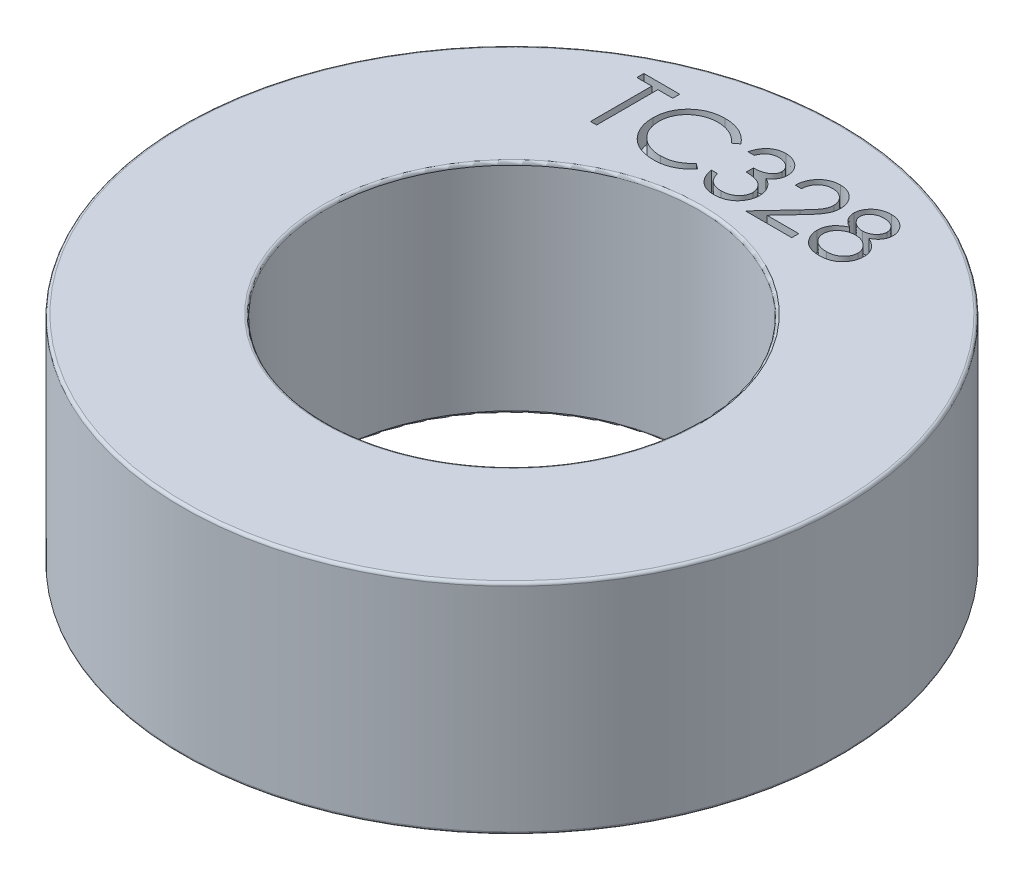
from build123d import *

# Parameters (mm, degrees)
CUT_EXTRUDE1_DEPTH = 1


with BuildPart() as part:
    # Toroidal Core TC328 → Revolve2 (revolve)
    with BuildSketch(Plane.XY, mode=Mode.PRIVATE) as revolve2_sk:
        with BuildLine():
            Line((9.696058459, 0), (16.753941541, 0))
            ThreePointArc((16.753941541, 0), (16.857220468, 0.042779532), (16.9, 0.146058459))
            Line((16.9, 0.146058459), (16.9, 11.053941541))
            ThreePointArc((16.9, 11.053941541), (16.857220468, 11.157220468), (16.753941541, 11.2))
            Line((16.753941541, 11.2), (9.696058459, 11.2))
            ThreePointArc((9.696058459, 11.2), (9.592779532, 11.157220468), (9.55, 11.053941541))
            Line((9.55, 11.053941541), (9.55, 0.146058459))
            ThreePointArc((9.55, 0.146058459), (9.592779532, 0.042779532), (9.696058459, 0))
        make_face()
    revolve(revolve2_sk.sketch.rotate(Axis((0, -8.107972275, 0), (0, 1, 0)), 90), axis=Axis((0, -8.107972275, 0), (0, 1, 0)))

    # Sketch1 → Cut-Extrude1 (cut)
    # profile 1 of 5: a face of its own
    with BuildSketch(Plane(origin=(0, 11.2, 0), x_dir=(1, 0, 0), z_dir=(0, 1, 0))):
        Polygon((-7.295148768, 13.702178807), (-7.295148768, 14.061153166), (-5.455405178, 14.061153166), (-5.455405178, 13.702178807), (-6.218225691, 13.702178807), (-6.218225691, 10.561153166), (-6.532328255, 10.561153166), (-6.532328255, 13.702178807), align=None)
    # profile 2 of 5: a face of its own
    with BuildSketch(Plane(origin=(0, 11.2, 0), x_dir=(1, 0, 0), z_dir=(0, 1, 0))):
        with BuildLine():
            Line((-1.686174409, 13.418925602), (-1.961014153, 13.208589063))
            add(Edge.make_bspline(
                [(-1.961014153, 13.208589063), (-1.980620041, 13.231955033), (-2.019567488, 13.278371949), (-2.08222669, 13.343551494), (-2.147528333, 13.404616755), (-2.215447454, 13.461858635), (-2.287206574, 13.5132754), (-2.361067373, 13.561546503), (-2.438265418, 13.604814241), (-2.545017152, 13.657277227), (-2.684665001, 13.712023382), (-2.86045984, 13.757926614), (-3.043970938, 13.787147789), (-3.169168538, 13.790312631), (-3.232849089, 13.791922397)],
                knots=[0, 0, 0, 0, 0.757959112, 1.505699292, 2.245454638, 2.979532153, 3.711538275, 4.438200793, 5.171680507, 5.909471876, 7.393775596, 8.890124382, 10.418191784, 12, 12, 12, 12], degree=3))
            add(Edge.make_bspline(
                [(-3.232849089, 13.791922397), (-3.267932388, 13.791518434), (-3.33777338, 13.790714258), (-3.441421854, 13.780105133), (-3.543134905, 13.765193923), (-3.642846371, 13.7430686), (-3.74042933, 13.715095981), (-3.836521732, 13.681670567), (-3.929732332, 13.640315727), (-4.02135057, 13.594607467), (-4.109129781, 13.542980022), (-4.192184829, 13.486666671), (-4.270212797, 13.426297574), (-4.343275409, 13.361646468), (-4.411447357, 13.293004507), (-4.474234668, 13.219640166), (-4.531420078, 13.141787992), (-4.584137103, 13.060474585), (-4.631349837, 12.975936793), (-4.670879716, 12.887861722), (-4.705884838, 12.797757619), (-4.733584081, 12.704606459), (-4.755508598, 12.609063693), (-4.770636261, 12.510872905), (-4.781124732, 12.410239225), (-4.781924909, 12.342029913), (-4.782328255, 12.307647557)],
                knots=[0, 0, 0, 0, 1.054917814, 2.100044995, 3.131103042, 4.146048494, 5.169673617, 6.183595914, 7.203665975, 8.234915748, 9.262203917, 10.264457458, 11.251630812, 12.227803204, 13.197192746, 14.159520551, 15.12972552, 16.100847026, 17.073214652, 18.039054194, 19.002613845, 19.979014051, 20.95965708, 21.949030935, 22.966165397, 24, 24, 24, 24], degree=3))
            add(Edge.make_bspline(
                [(-4.782328255, 12.307647557), (-4.781066436, 12.255916237), (-4.778589022, 12.154348652), (-4.756540688, 12.005578042), (-4.723035597, 11.863057368), (-4.67282002, 11.727677526), (-4.610900969, 11.597769168), (-4.532660358, 11.475530314), (-4.44204382, 11.35911375), (-4.337769401, 11.251270802), (-4.223363585, 11.152757077), (-4.100615673, 11.066006495), (-3.969831385, 10.993691613), (-3.832454755, 10.933515666), (-3.687428641, 10.887258938), (-3.535013839, 10.854694815), (-3.375541844, 10.833452634), (-3.266572444, 10.831418946), (-3.211114313, 10.830383935)],
                knots=[0, 0, 0, 0, 1.029171465, 2.020641659, 2.987623507, 3.938342917, 4.889210282, 5.84687017, 6.821220943, 7.821438502, 8.827599549, 9.822697543, 10.807740252, 11.797342354, 12.80366471, 13.83203677, 14.896651826, 16, 16, 16, 16], degree=3))
            add(Edge.make_bspline(
                [(-3.211114313, 10.830383935), (-3.150011624, 10.832072715), (-3.029746915, 10.835396638), (-2.853378889, 10.863555887), (-2.684543123, 10.909213805), (-2.523230536, 10.973111727), (-2.36989589, 11.056177015), (-2.22429923, 11.156874892), (-2.086317659, 11.276163225), (-2.003346377, 11.367246353), (-1.961014153, 11.413717269)],
                knots=[0, 0, 0, 0, 1.028121516, 2.023589091, 2.998037872, 3.967518031, 4.937445131, 5.927275754, 6.942489185, 8, 8, 8, 8], degree=3))
            Line((-1.961014153, 11.413717269), (-1.686174409, 11.205484096))
            add(Edge.make_bspline(
                [(-1.686174409, 11.205484096), (-1.708292519, 11.176945644), (-1.752422794, 11.120005437), (-1.823880811, 11.039733728), (-1.899158109, 10.964229692), (-1.978813819, 10.894102071), (-2.06193161, 10.827947605), (-2.150003923, 10.767645774), (-2.241872955, 10.71235489), (-2.337227434, 10.661727965), (-2.435966047, 10.616810718), (-2.537970482, 10.57835695), (-2.642801057, 10.545232061), (-2.750462566, 10.517980124), (-2.861178322, 10.49670904), (-2.974548797, 10.482489365), (-3.090818672, 10.472747451), (-3.169260093, 10.471859535), (-3.209010948, 10.471409576)],
                knots=[0, 0, 0, 0, 0.986787822, 1.968848986, 2.935600012, 3.899624008, 4.868462664, 5.837806735, 6.815139263, 7.798259679, 8.787526145, 9.778297419, 10.776456485, 11.791383307, 12.812564526, 13.85620153, 14.913611965, 16, 16, 16, 16], degree=3))
            add(Edge.make_bspline(
                [(-3.209010948, 10.471409576), (-3.246654615, 10.471671569), (-3.321090305, 10.472189627), (-3.430989056, 10.480581794), (-3.537978637, 10.492031531), (-3.641753263, 10.509271662), (-3.742879238, 10.529616002), (-3.840439822, 10.556887259), (-3.935395033, 10.587436425), (-4.027363374, 10.623341412), (-4.116423073, 10.663857595), (-4.202286885, 10.709649154), (-4.284915317, 10.760331018), (-4.365120738, 10.814786029), (-4.441718322, 10.87476333), (-4.515371847, 10.939429965), (-4.586494323, 11.008567976), (-4.630497008, 11.058422829), (-4.652620723, 11.083488903)],
                knots=[0, 0, 0, 0, 1.114604814, 2.203992996, 3.262667896, 4.300477797, 5.318619304, 6.316056647, 7.298880507, 8.271930387, 9.238335007, 10.195173496, 11.151986948, 12.108099108, 13.064862484, 14.031167946, 15.010108607, 16, 16, 16, 16], degree=3))
            add(Edge.make_bspline(
                [(-4.652620723, 11.083488903), (-4.688056367, 11.127030092), (-4.758499843, 11.213586803), (-4.848625527, 11.353872784), (-4.925773082, 11.500340993), (-4.988149003, 11.653760921), (-5.036911736, 11.813788309), (-5.070692931, 11.980503823), (-5.092644536, 12.153751765), (-5.095154825, 12.271588554), (-5.096430819, 12.331485698)],
                knots=[0, 0, 0, 0, 0.994628077, 1.977248131, 2.950237994, 3.925870899, 4.908910175, 5.911660606, 6.938484602, 8, 8, 8, 8], degree=3))
            add(Edge.make_bspline(
                [(-5.096430819, 12.331485698), (-5.094875626, 12.394441152), (-5.09181588, 12.518302076), (-5.065820084, 12.700076029), (-5.024001288, 12.874227428), (-4.964604399, 13.040431173), (-4.889299048, 13.199561453), (-4.796272434, 13.350402658), (-4.686605292, 13.493919458), (-4.561157724, 13.627934209), (-4.423590389, 13.750473562), (-4.276271575, 13.858279765), (-4.119489628, 13.947997281), (-3.954971776, 14.022993444), (-3.781486095, 14.080637907), (-3.599402726, 14.120991094), (-3.409063811, 14.14610821), (-3.279201385, 14.149283418), (-3.213217678, 14.150896756)],
                knots=[0, 0, 0, 0, 1.032925535, 2.032216505, 3.007276963, 3.968222605, 4.92396291, 5.891752235, 6.871517503, 7.883894988, 8.900124299, 9.891468569, 10.874487609, 11.85992873, 12.854644235, 13.869047385, 14.917252991, 16, 16, 16, 16], degree=3))
            add(Edge.make_bspline(
                [(-3.213217678, 14.150896756), (-3.173003206, 14.150414618), (-3.093402709, 14.149460274), (-2.975650057, 14.140154131), (-2.86100773, 14.124640525), (-2.749396748, 14.103524455), (-2.640274131, 14.077317134), (-2.534473891, 14.043176836), (-2.431375204, 14.004140304), (-2.331628296, 13.959181838), (-2.235711745, 13.908715097), (-2.143655427, 13.853299473), (-2.056190568, 13.793003668), (-1.97270172, 13.728340493), (-1.894585509, 13.657941933), (-1.81962403, 13.583744337), (-1.750362952, 13.503610513), (-1.707609757, 13.447205579), (-1.686174409, 13.418925602)],
                knots=[0, 0, 0, 0, 1.096760587, 2.17092713, 3.219439832, 4.250915756, 5.268269357, 6.278326846, 7.281116186, 8.274029601, 9.260640565, 10.235837813, 11.203064059, 12.156899882, 13.114053108, 14.069676657, 15.032185724, 16, 16, 16, 16], degree=3))
        make_face()
    # profile 3 of 5: a face of its own
    with BuildSketch(Plane(origin=(0, 11.2, 0), x_dir=(1, 0, 0), z_dir=(0, 1, 0))):
        with BuildLine():
            Line((-0.833610306, 13.253460858), (-1.147712871, 13.253460858))
            add(Edge.make_bspline(
                [(-1.147712871, 13.253460858), (-1.13920332, 13.288693342), (-1.122567844, 13.357569967), (-1.087870271, 13.455977228), (-1.050071016, 13.549100749), (-1.004681911, 13.635196823), (-0.955173157, 13.715995725), (-0.898450435, 13.78966485), (-0.837130713, 13.858077815), (-0.769305763, 13.918791053), (-0.698177102, 13.973768782), (-0.622742482, 14.020643839), (-0.544519588, 14.060967992), (-0.462966455, 14.094188224), (-0.377840284, 14.119213748), (-0.28991066, 14.137370553), (-0.19894716, 14.149161668), (-0.13719957, 14.150312431), (-0.105845883, 14.150896756)],
                knots=[0, 0, 0, 0, 1.162005537, 2.271625781, 3.343758855, 4.383309926, 5.390229558, 6.379919256, 7.361854164, 8.333198761, 9.295911338, 10.242430842, 11.177959212, 12.116337295, 13.062827104, 14.020064771, 14.994644689, 16, 16, 16, 16], degree=3))
            add(Edge.make_bspline(
                [(-0.105845883, 14.150896756), (-0.060163141, 14.149517526), (0.03020587, 14.14678915), (0.162968917, 14.121874714), (0.290995736, 14.082449581), (0.412884983, 14.027975854), (0.526103416, 13.960788541), (0.626839603, 13.880823804), (0.713728114, 13.789624503), (0.786622491, 13.688891938), (0.84369749, 13.581236429), (0.885783864, 13.470436272), (0.911405545, 13.3567543), (0.914726102, 13.279997021), (0.916389694, 13.241541788)],
                knots=[0, 0, 0, 0, 1.083050992, 2.142477498, 3.193116406, 4.255571735, 5.30263384, 6.308962982, 7.297363603, 8.282367274, 9.249857812, 10.179914175, 11.08814088, 12, 12, 12, 12], degree=3))
            add(Edge.make_bspline(
                [(0.916389694, 13.241541788), (0.915226102, 13.204534993), (0.912949135, 13.132118439), (0.89361543, 13.026396942), (0.861079167, 12.926755341), (0.816009404, 12.832774179), (0.757667854, 12.745049339), (0.686995157, 12.663383448), (0.603492495, 12.58741429), (0.540213557, 12.543894817), (0.507635687, 12.521489705)],
                knots=[0, 0, 0, 0, 1.024540389, 2.004866551, 2.965041327, 3.920577974, 4.882998113, 5.874504559, 6.905732034, 8, 8, 8, 8], degree=3))
            add(Edge.make_bspline(
                [(0.507635687, 12.521489705), (0.544867442, 12.503511533), (0.618634316, 12.467891575), (0.719184845, 12.398035818), (0.810462721, 12.31737947), (0.86136644, 12.254436818), (0.886942578, 12.22281182)],
                knots=[0, 0, 0, 0, 1.015518401, 2.012035669, 3.001164323, 4, 4, 4, 4], degree=3))
            add(Edge.make_bspline(
                [(0.886942578, 12.22281182), (0.90378392, 12.199754068), (0.937190817, 12.154016152), (0.97842635, 12.080479726), (1.015835465, 12.006128237), (1.044985684, 11.928968831), (1.067559551, 11.849895817), (1.083695583, 11.768773421), (1.093719724, 11.685535398), (1.095155276, 11.629222918), (1.095876873, 11.600916788)],
                knots=[0, 0, 0, 0, 1.025084078, 2.033381695, 3.024893161, 4.013698104, 4.991890475, 5.976764909, 6.982997093, 8, 8, 8, 8], degree=3))
            add(Edge.make_bspline(
                [(1.095876873, 11.600916788), (1.094082359, 11.551907067), (1.090501777, 11.454118265), (1.058497703, 11.309643543), (1.008884462, 11.168418041), (0.938427526, 11.033343202), (0.852560018, 10.906962821), (0.750402693, 10.793886512), (0.633116285, 10.696687907), (0.502310636, 10.615477679), (0.360593508, 10.550559757), (0.209017916, 10.505502314), (0.049767862, 10.476156315), (-0.059439436, 10.473009446), (-0.114960467, 10.471409576)],
                knots=[0, 0, 0, 0, 0.955779014, 1.907060117, 2.875433937, 3.871313158, 4.872415639, 5.851225146, 6.836215519, 7.83643374, 8.849228613, 9.86973379, 10.916971861, 12, 12, 12, 12], degree=3))
            add(Edge.make_bspline(
                [(-0.114960467, 10.471409576), (-0.152379767, 10.47227779), (-0.226008472, 10.473986144), (-0.33425197, 10.485664745), (-0.43757367, 10.50699475), (-0.536113268, 10.535698056), (-0.629958304, 10.572089798), (-0.718822409, 10.617408496), (-0.803252303, 10.670719998), (-0.882451254, 10.732653585), (-0.956409822, 10.801934925), (-1.023162546, 10.879793935), (-1.083822339, 10.964791339), (-1.136764978, 11.057914395), (-1.18440193, 11.157959653), (-1.223582887, 11.266208151), (-1.258068455, 11.381692173), (-1.27410192, 11.462169913), (-1.282328255, 11.503460858)],
                knots=[0, 0, 0, 0, 1.048658725, 2.063410685, 3.046034179, 4.001477787, 4.936774919, 5.862367409, 6.792675028, 7.730719943, 8.675894397, 9.627829632, 10.600096036, 11.597688215, 12.626045268, 13.701542398, 14.82072376, 16, 16, 16, 16], degree=3))
            Line((-1.282328255, 11.503460858), (-0.968225691, 11.503460858))
            add(Edge.make_bspline(
                [(-0.968225691, 11.503460858), (-0.9600424, 11.476511845), (-0.944125187, 11.424093673), (-0.917030889, 11.348653368), (-0.886162617, 11.279495315), (-0.853048058, 11.216112193), (-0.818269612, 11.15787979), (-0.779354687, 11.106337921), (-0.739185542, 11.059222719), (-0.708906189, 11.032678107), (-0.694087069, 11.01968682)],
                knots=[0, 0, 0, 0, 1.198163088, 2.33053128, 3.407730985, 4.417276592, 5.372219308, 6.28897303, 7.162600585, 8, 8, 8, 8], degree=3))
            add(Edge.make_bspline(
                [(-0.694087069, 11.01968682), (-0.674490493, 11.004578486), (-0.63535783, 10.974408454), (-0.571589599, 10.935906826), (-0.504524713, 10.9025458), (-0.432710038, 10.877062105), (-0.357695268, 10.855484444), (-0.278267903, 10.841363925), (-0.195128686, 10.831675753), (-0.138360922, 10.830820822), (-0.109351492, 10.830383935)],
                knots=[0, 0, 0, 0, 0.946170439, 1.889420265, 2.845303464, 3.807233317, 4.801018734, 5.828864929, 6.890507805, 8, 8, 8, 8], degree=3))
            add(Edge.make_bspline(
                [(-0.109351492, 10.830383935), (-0.07659799, 10.830999841), (-0.012551343, 10.83220419), (0.080903517, 10.843279897), (0.169810964, 10.85941031), (0.25318389, 10.884323293), (0.332114397, 10.915104145), (0.405496047, 10.95375255), (0.474292153, 10.999097272), (0.537621558, 11.05063643), (0.594567066, 11.107057925), (0.644706579, 11.166070997), (0.687331241, 11.227426826), (0.721714819, 11.291464947), (0.748865369, 11.357920176), (0.76734857, 11.426979005), (0.780200085, 11.498076271), (0.781246697, 11.54640524), (0.781774309, 11.570768551)],
                knots=[0, 0, 0, 0, 1.217147791, 2.380027433, 3.494444702, 4.572153297, 5.609568379, 6.639424714, 7.649109417, 8.668170816, 9.669597737, 10.625200337, 11.543417969, 12.441394052, 13.322311151, 14.205496177, 15.095365482, 16, 16, 16, 16], degree=3))
            add(Edge.make_bspline(
                [(0.781774309, 11.570768551), (0.780244007, 11.60337989), (0.777191019, 11.668440298), (0.753882439, 11.764157872), (0.715543575, 11.856381284), (0.661871064, 11.943537075), (0.596535335, 12.024312976), (0.520170428, 12.096384459), (0.4321422, 12.15585455), (0.351122331, 12.196943206), (0.279357175, 12.224980281), (0.21794179, 12.243655246), (0.149185187, 12.259468901), (0.073918838, 12.274181173), (-0.008424379, 12.286702521), (-0.097754817, 12.297144337), (-0.194090578, 12.305499378), (-0.260781744, 12.309230473), (-0.295148768, 12.311153166)],
                knots=[0, 0, 0, 0, 1.07054697, 2.135767047, 3.216561865, 4.33974944, 5.486079747, 6.621378074, 7.775625952, 8.963672916, 9.598146892, 10.304877434, 11.070270905, 11.915000392, 12.823868403, 13.805723172, 14.86925407, 16, 16, 16, 16], degree=3))
            Line((-0.295148768, 12.311153166), (-0.295148768, 12.670127525))
            add(Edge.make_bspline(
                [(-0.295148768, 12.670127525), (-0.251847602, 12.670862329), (-0.167031256, 12.672301629), (-0.043136951, 12.689709639), (0.075336361, 12.713790267), (0.185763103, 12.750675459), (0.286411817, 12.793515756), (0.373731419, 12.843367966), (0.446498566, 12.898782715), (0.504359637, 12.960615324), (0.547888866, 13.026930372), (0.579715663, 13.09604703), (0.59851599, 13.168571091), (0.601025657, 13.218065758), (0.602287129, 13.242944031)],
                knots=[0, 0, 0, 0, 1.321986639, 2.589447074, 3.816329219, 5.01088745, 6.139805852, 7.153945165, 8.075214402, 8.924034688, 9.728124013, 10.488707548, 11.240355623, 12, 12, 12, 12], degree=3))
            add(Edge.make_bspline(
                [(0.602287129, 13.242944031), (0.601872718, 13.261221777), (0.601048268, 13.297584484), (0.59065099, 13.350709552), (0.575026949, 13.402210498), (0.553547219, 13.451868309), (0.524797021, 13.499338582), (0.490391034, 13.545026031), (0.449422934, 13.58866981), (0.402477487, 13.62935013), (0.352065682, 13.668119367), (0.296815907, 13.701033004), (0.238394032, 13.729178066), (0.176735377, 13.752387568), (0.111639847, 13.769846856), (0.043413289, 13.782382698), (-0.028074394, 13.790220353), (-0.076846126, 13.791348769), (-0.101639153, 13.791922397)],
                knots=[0, 0, 0, 0, 0.884392785, 1.759457502, 2.611959086, 3.489218968, 4.37281399, 5.2945488, 6.255912374, 7.266815255, 8.301784654, 9.332968512, 10.37626691, 11.440494194, 12.520033166, 13.637162961, 14.798855837, 16, 16, 16, 16], degree=3))
            add(Edge.make_bspline(
                [(-0.101639153, 13.791922397), (-0.141490821, 13.790531035), (-0.219330397, 13.787813381), (-0.331545314, 13.764010368), (-0.435864648, 13.726032284), (-0.515603315, 13.680699265), (-0.574485889, 13.635948831), (-0.616562827, 13.596866445), (-0.657883337, 13.553433621), (-0.695729014, 13.502975246), (-0.734002991, 13.448908455), (-0.768847552, 13.388484774), (-0.802707245, 13.32328038), (-0.823109794, 13.277184745), (-0.833610306, 13.253460858)],
                knots=[0, 0, 0, 0, 1.472543308, 2.876219568, 4.221790263, 5.565193594, 6.249813518, 6.953379497, 7.687249741, 8.463570142, 9.283606569, 10.136032583, 11.040678096, 12, 12, 12, 12], degree=3))
        make_face()
    # profile 4 of 5: a face of its own
    with BuildSketch(Plane(origin=(0, 11.2, 0), x_dir=(1, 0, 0), z_dir=(0, 1, 0))):
        with BuildLine():
            Line((1.858697386, 12.984230089), (1.544594822, 12.984230089))
            add(Edge.make_bspline(
                [(1.544594822, 12.984230089), (1.546641975, 13.025900977), (1.550662529, 13.107741491), (1.569490818, 13.227065398), (1.596431695, 13.341120197), (1.634523149, 13.448990111), (1.681829427, 13.551628918), (1.738559454, 13.648628933), (1.805753305, 13.739620122), (1.881960039, 13.823758965), (1.964728678, 13.900946536), (2.054034617, 13.967601779), (2.147879645, 14.02391945), (2.245979044, 14.071000692), (2.349439607, 14.106340538), (2.457322465, 14.132562178), (2.570101602, 14.148338524), (2.646941624, 14.150034309), (2.686021104, 14.150896756)],
                knots=[0, 0, 0, 0, 1.10065271, 2.161652631, 3.183658789, 4.190468796, 5.17591951, 6.163126047, 7.15150782, 8.156236427, 9.156009102, 10.134482811, 11.092018607, 12.041330605, 13.001268258, 13.972401359, 14.968799086, 16, 16, 16, 16], degree=3))
            add(Edge.make_bspline(
                [(2.686021104, 14.150896756), (2.724399178, 14.149998299), (2.799810723, 14.148232865), (2.909872737, 14.133071835), (3.014650031, 14.109326244), (3.113937798, 14.076010827), (3.206943863, 14.0312264), (3.294366907, 13.977428861), (3.377247718, 13.91520903), (3.451854501, 13.841955216), (3.520362581, 13.763752832), (3.579464836, 13.680264928), (3.630077999, 13.594035643), (3.672265679, 13.504407441), (3.703321818, 13.410536413), (3.726900026, 13.31378921), (3.74022744, 13.213164399), (3.742272863, 13.145057843), (3.74331277, 13.110432012)],
                knots=[0, 0, 0, 0, 1.111607364, 2.184268762, 3.212621178, 4.221274766, 5.211760367, 6.196651075, 7.1921475, 8.207485113, 9.220403448, 10.201281604, 11.166441695, 12.114753415, 13.065576456, 14.026450734, 14.996634279, 16, 16, 16, 16], degree=3))
            add(Edge.make_bspline(
                [(3.74331277, 13.110432012), (3.741619508, 13.061684178), (3.738262696, 12.965043964), (3.70954832, 12.823029101), (3.664701809, 12.685435682), (3.610704452, 12.57469838), (3.556232008, 12.485464886), (3.5071445, 12.411996181), (3.449679689, 12.332890713), (3.383001191, 12.248413376), (3.308488319, 12.15790247), (3.225466156, 12.061412675), (3.133342674, 11.959940905), (3.068684173, 11.890635304), (3.035179758, 11.854722878)],
                knots=[0, 0, 0, 0, 1.184426356, 2.348067706, 3.509069118, 4.696110526, 5.333549288, 6.050745305, 6.844228056, 7.710549037, 8.667450064, 9.695053472, 10.805634456, 12, 12, 12, 12], degree=3))
            Line((3.035179758, 11.854722878), (2.159478636, 10.920127525))
            Line((2.159478636, 10.920127525), (3.788184565, 10.920127525))
            Line((3.788184565, 10.920127525), (3.788184565, 10.561153166))
            Line((3.788184565, 10.561153166), (1.409979437, 10.561153166))
            Line((1.409979437, 10.561153166), (2.767351232, 12.009670794))
            add(Edge.make_bspline(
                [(2.767351232, 12.009670794), (2.800399119, 12.044169101), (2.863877346, 12.110433287), (2.953659923, 12.207176248), (3.034298911, 12.296925788), (3.106316304, 12.379512337), (3.168149809, 12.456143905), (3.223022041, 12.524338608), (3.266987632, 12.587093058), (3.314703028, 12.659833672), (3.360917009, 12.74864599), (3.400629365, 12.857179679), (3.424844214, 12.968906931), (3.427749049, 13.044408968), (3.429210206, 13.08238714)],
                knots=[0, 0, 0, 0, 1.329631726, 2.553950428, 3.673215718, 4.687767853, 5.603093632, 6.413772471, 7.123043292, 7.734684054, 8.834405432, 9.900288307, 10.943827018, 12, 12, 12, 12], degree=3))
            add(Edge.make_bspline(
                [(3.429210206, 13.08238714), (3.428574464, 13.106268539), (3.427321538, 13.153334189), (3.416263841, 13.222339948), (3.399553334, 13.288904762), (3.375608076, 13.353233381), (3.344001336, 13.414679033), (3.305527956, 13.473316513), (3.261137893, 13.530005479), (3.209786624, 13.583158777), (3.153375104, 13.631839982), (3.093780854, 13.674964068), (3.03073075, 13.711003178), (2.964490628, 13.740546676), (2.895245158, 13.763722057), (2.822860413, 13.779780636), (2.747536397, 13.78986312), (2.696102901, 13.791227292), (2.669895302, 13.791922397)],
                knots=[0, 0, 0, 0, 0.991446411, 1.95395049, 2.89581595, 3.838931463, 4.798493298, 5.75982156, 6.748411868, 7.785213223, 8.824556874, 9.840280684, 10.836137867, 11.835679398, 12.848801643, 13.863922112, 14.911575587, 16, 16, 16, 16], degree=3))
            add(Edge.make_bspline(
                [(2.669895302, 13.791922397), (2.64252447, 13.791207365), (2.588772674, 13.789803159), (2.509853641, 13.779980495), (2.434567863, 13.763034655), (2.36272596, 13.73985798), (2.294206374, 13.710399432), (2.22934233, 13.673707687), (2.168279441, 13.629924194), (2.110902918, 13.580283637), (2.058038939, 13.525016036), (2.011592063, 13.463406073), (1.971008049, 13.396578658), (1.935598815, 13.324714107), (1.906843125, 13.247160327), (1.884869975, 13.164192622), (1.867483128, 13.076171241), (1.861674607, 13.015386156), (1.858697386, 12.984230089)],
                knots=[0, 0, 0, 0, 1.031018746, 2.02475058, 2.990194455, 3.934040569, 4.864654155, 5.795059489, 6.735614925, 7.690564532, 8.649604399, 9.611025574, 10.590972636, 11.591080095, 12.624614302, 13.701020113, 14.821632451, 16, 16, 16, 16], degree=3))
        make_face()
    # profile 5 of 5: a face of its own
    with BuildSketch(Plane(origin=(0, 11.2, 0), x_dir=(1, 0, 0), z_dir=(0, 1, 0))):
        with BuildLine():
            add(Edge.make_bspline(
                [(5.803909726, 12.510972878), (5.832558273, 12.496034922), (5.888432507, 12.466900919), (5.968009716, 12.419990091), (6.040734717, 12.370549126), (6.108625279, 12.320913267), (6.170488629, 12.269181615), (6.225633042, 12.215148459), (6.275420662, 12.160162514), (6.318847446, 12.103292674), (6.357044283, 12.044690025), (6.390056418, 11.984200752), (6.418273621, 11.921957418), (6.44063656, 11.857280588), (6.459058351, 11.791120326), (6.471733956, 11.722622344), (6.478550874, 11.652238003), (6.479839688, 11.604669702), (6.480492258, 11.580584256)],
                knots=[0, 0, 0, 0, 1.272397273, 2.481599622, 3.635517121, 4.734568067, 5.792894095, 6.808321871, 7.773003508, 8.711915296, 9.623354172, 10.525449501, 11.423591555, 12.311487226, 13.218079475, 14.126165749, 15.051214107, 16, 16, 16, 16], degree=3))
            add(Edge.make_bspline(
                [(6.480492258, 11.580584256), (6.479720837, 11.546886523), (6.478193906, 11.480186066), (6.464893922, 11.381739955), (6.444980944, 11.286128173), (6.415901432, 11.193371682), (6.378188041, 11.103982309), (6.331711205, 11.017883535), (6.2791, 10.933664226), (6.23684776, 10.881844825), (6.215468219, 10.85562432)],
                knots=[0, 0, 0, 0, 1.025265484, 2.029385089, 3.018602448, 3.995076438, 4.983346944, 5.966715145, 6.97116228, 8, 8, 8, 8], degree=3))
            add(Edge.make_bspline(
                [(6.215468219, 10.85562432), (6.187631745, 10.825030546), (6.132302779, 10.764221053), (6.037519852, 10.685270243), (5.933497968, 10.618920849), (5.820639635, 10.564848954), (5.699246534, 10.522763096), (5.569344529, 10.492520578), (5.430680376, 10.475198148), (5.335374905, 10.472694159), (5.286481841, 10.471409576)],
                knots=[0, 0, 0, 0, 0.954267603, 1.896743057, 2.838368354, 3.796610408, 4.779680527, 5.799409237, 6.871065594, 8, 8, 8, 8], degree=3))
            add(Edge.make_bspline(
                [(5.286481841, 10.471409576), (5.239468452, 10.472562054), (5.147985173, 10.474804659), (5.014827296, 10.489999091), (4.890704226, 10.516626958), (4.774894258, 10.553071567), (4.668095564, 10.600481795), (4.570612463, 10.659490204), (4.481038491, 10.727721646), (4.402092017, 10.807135724), (4.332003573, 10.892193597), (4.27043552, 10.979945206), (4.219261442, 11.070398564), (4.175934347, 11.162204931), (4.142766324, 11.256651085), (4.119794114, 11.353251098), (4.105204799, 11.451836241), (4.103263665, 11.518367894), (4.102287129, 11.551838262)],
                knots=[0, 0, 0, 0, 1.256902934, 2.445805442, 3.576955095, 4.645999104, 5.686449165, 6.692658513, 7.68621702, 8.689161843, 9.678783111, 10.630372946, 11.551080876, 12.453998257, 13.34127905, 14.221779781, 15.105423033, 16, 16, 16, 16], degree=3))
            add(Edge.make_bspline(
                [(4.102287129, 11.551838262), (4.10286501, 11.576397454), (4.104007107, 11.624935086), (4.111911956, 11.696644414), (4.124620417, 11.766440549), (4.141879874, 11.834581293), (4.1652709, 11.900570565), (4.193513033, 11.964721039), (4.226444986, 12.027105138), (4.264526151, 12.088064019), (4.308828175, 12.146743531), (4.358991825, 12.204139526), (4.416019693, 12.259361393), (4.479277352, 12.313083818), (4.548041892, 12.366259792), (4.624099422, 12.41601552), (4.70543369, 12.465873485), (4.763239096, 12.495681811), (4.792892097, 12.510972878)],
                knots=[0, 0, 0, 0, 0.941657376, 1.861047343, 2.762797495, 3.66048619, 4.553285746, 5.444104102, 6.34607688, 7.256116206, 8.197091036, 9.162375105, 10.176350973, 11.237807142, 12.343728897, 13.50695164, 14.721116704, 16, 16, 16, 16], degree=3))
            add(Edge.make_bspline(
                [(4.792892097, 12.510972878), (4.752300723, 12.533107646), (4.67370446, 12.575966754), (4.569635019, 12.65471356), (4.480244395, 12.740001375), (4.407989678, 12.833631169), (4.35111745, 12.932678044), (4.312098845, 13.036522296), (4.285702361, 13.14323841), (4.283087534, 13.216144606), (4.281774309, 13.252759737)],
                knots=[0, 0, 0, 0, 1.166880483, 2.259407225, 3.286803203, 4.280235371, 5.237608625, 6.161067461, 7.076446754, 8, 8, 8, 8], degree=3))
            add(Edge.make_bspline(
                [(4.281774309, 13.252759737), (4.283409733, 13.290057295), (4.286697221, 13.365031892), (4.313280541, 13.476638015), (4.356600608, 13.58625458), (4.415521605, 13.693350293), (4.488908821, 13.794300508), (4.576955367, 13.884841454), (4.677558664, 13.964152936), (4.790216531, 14.030729109), (4.911452766, 14.084912768), (5.03936849, 14.122291191), (5.171734983, 14.146727307), (5.261832703, 14.149493962), (5.307515495, 14.150896756)],
                knots=[0, 0, 0, 0, 0.888701115, 1.786444228, 2.72001202, 3.692817113, 4.693886446, 5.687152267, 6.695133018, 7.739871481, 8.800368666, 9.853104506, 10.91144658, 12, 12, 12, 12], degree=3))
            add(Edge.make_bspline(
                [(5.307515495, 14.150896756), (5.35201931, 14.149450413), (5.439775763, 14.146598389), (5.568770391, 14.122811511), (5.692195268, 14.083081991), (5.809624767, 14.029184768), (5.918956634, 13.962797827), (6.015558944, 13.882396953), (6.100891526, 13.792255402), (6.17147592, 13.691335799), (6.229638809, 13.584651605), (6.27013971, 13.473029084), (6.296091684, 13.358880025), (6.299365049, 13.281642021), (6.301005078, 13.242944031)],
                knots=[0, 0, 0, 0, 1.072916533, 2.115669174, 3.151510826, 4.193348718, 5.225979165, 6.227137561, 7.216255879, 8.211077061, 9.189680878, 10.138522389, 11.067357538, 12, 12, 12, 12], degree=3))
            add(Edge.make_bspline(
                [(6.301005078, 13.242944031), (6.299570518, 13.204967368), (6.296753122, 13.130383358), (6.273053182, 13.021656838), (6.233139869, 12.919834799), (6.178645706, 12.823761847), (6.107620218, 12.735180349), (6.021011485, 12.652963879), (5.919510007, 12.576437051), (5.843249121, 12.533250687), (5.803909726, 12.510972878)],
                knots=[0, 0, 0, 0, 0.975232327, 1.915300861, 2.843280834, 3.77672583, 4.742871857, 5.749627742, 6.839139064, 8, 8, 8, 8], degree=3))
        make_face()
        with BuildLine():
            add(Edge.make_bspline(
                [(5.28998745, 13.791922397), (5.265436644, 13.791270956), (5.217404533, 13.789996454), (5.146975862, 13.783337817), (5.080003494, 13.7703846), (5.015787694, 13.753145888), (4.955208882, 13.7298579), (4.897444327, 13.702462891), (4.843477137, 13.669156825), (4.792655834, 13.631795628), (4.74690506, 13.590702721), (4.706300508, 13.547889003), (4.672572394, 13.502513611), (4.643931284, 13.455705251), (4.623149767, 13.406074675), (4.607585463, 13.355143498), (4.597064072, 13.302268114), (4.596275682, 13.266131604), (4.595876873, 13.247851884)],
                knots=[0, 0, 0, 0, 1.203892937, 2.355340988, 3.463153438, 4.544400666, 5.610487187, 6.640501085, 7.674077295, 8.714426146, 9.728707835, 10.68524104, 11.601827946, 12.495867327, 13.368432065, 14.231010473, 15.105153427, 16, 16, 16, 16], degree=3))
            add(Edge.make_bspline(
                [(4.595876873, 13.247851884), (4.59656424, 13.229571374), (4.597922576, 13.193446461), (4.608427704, 13.140100596), (4.624084559, 13.087678959), (4.64873522, 13.037428048), (4.678301578, 12.987604689), (4.714793054, 12.939454103), (4.758282082, 12.892808718), (4.807309522, 12.848065276), (4.86072106, 12.806166513), (4.917305104, 12.769793332), (4.976351495, 12.739359221), (5.037253564, 12.714029817), (5.100632012, 12.694339879), (5.166098485, 12.680371233), (5.233663987, 12.671689236), (5.279444568, 12.670652215), (5.302607642, 12.670127525)],
                knots=[0, 0, 0, 0, 0.873023192, 1.725219244, 2.590779336, 3.480155217, 4.391973325, 5.357036234, 6.360879153, 7.436073238, 8.526419356, 9.601555421, 10.645666583, 11.697338044, 12.750135903, 13.812665442, 14.89329948, 16, 16, 16, 16], degree=3))
            add(Edge.make_bspline(
                [(5.302607642, 12.670127525), (5.332357746, 12.671000392), (5.391564114, 12.672737505), (5.478843445, 12.688888679), (5.56370609, 12.714294597), (5.645244994, 12.749054563), (5.721349579, 12.792682423), (5.789189648, 12.844915441), (5.84818654, 12.904547538), (5.897727151, 12.970650374), (5.936136997, 13.041001962), (5.966038805, 13.111602255), (5.98350002, 13.183204486), (5.985777587, 13.23117145), (5.986902514, 13.254863102)],
                knots=[0, 0, 0, 0, 1.076279235, 2.141928126, 3.20205304, 4.278698113, 5.344010996, 6.36967002, 7.368914609, 8.37248503, 9.349703398, 10.264243087, 11.142681841, 12, 12, 12, 12], degree=3))
            add(Edge.make_bspline(
                [(5.986902514, 13.254863102), (5.986370616, 13.271491138), (5.985314876, 13.304495406), (5.97661482, 13.353233771), (5.962238987, 13.400863355), (5.942775907, 13.447777625), (5.917166112, 13.493318357), (5.886801925, 13.538201445), (5.849917423, 13.581417209), (5.80852099, 13.623972758), (5.761575581, 13.663356781), (5.709171669, 13.697991492), (5.651577919, 13.727403848), (5.588792969, 13.751292603), (5.521048045, 13.769234953), (5.44865517, 13.7826713), (5.371010723, 13.790244412), (5.317580972, 13.791350937), (5.28998745, 13.791922397)],
                knots=[0, 0, 0, 0, 0.814439003, 1.616544685, 2.417341072, 3.248991801, 4.09997495, 4.973547432, 5.9003056, 6.880240646, 7.880314356, 8.896779544, 9.951930927, 11.043077905, 12.18215768, 13.381699519, 14.647792085, 16, 16, 16, 16], degree=3))
        make_face(mode=Mode.SUBTRACT)
        with BuildLine():
            add(Edge.make_bspline(
                [(5.310319982, 12.311153166), (5.279194196, 12.310599525), (5.218133, 12.309513415), (5.128676072, 12.297423915), (5.042822906, 12.280594522), (4.96086297, 12.255063683), (4.882830873, 12.221867193), (4.808304191, 12.181932653), (4.737853061, 12.13472721), (4.672450335, 12.080850595), (4.612727005, 12.022791141), (4.560328705, 11.961329005), (4.515831185, 11.897606473), (4.479997934, 11.830814243), (4.450586202, 11.762366632), (4.431272324, 11.690559037), (4.418890613, 11.616771924), (4.417227981, 11.566611826), (4.416389694, 11.541321435)],
                knots=[0, 0, 0, 0, 1.140299081, 2.23698856, 3.303958914, 4.344563908, 5.37730929, 6.408454204, 7.439741482, 8.480804886, 9.510774543, 10.48932336, 11.43758569, 12.353841022, 13.263987381, 14.161954604, 15.073269652, 16, 16, 16, 16], degree=3))
            add(Edge.make_bspline(
                [(4.416389694, 11.541321435), (4.417752952, 11.509890529), (4.420457626, 11.447532346), (4.441914265, 11.355369275), (4.4763498, 11.26614822), (4.524375016, 11.180596267), (4.583842589, 11.100646161), (4.656969057, 11.030957385), (4.739209894, 10.969035906), (4.833347748, 10.918955373), (4.936176214, 10.878960518), (5.047667943, 10.851404555), (5.166222862, 10.833163105), (5.248082454, 10.831324924), (5.28998745, 10.830383935)],
                knots=[0, 0, 0, 0, 0.898778495, 1.783155532, 2.693654817, 3.627872908, 4.583023416, 5.533784346, 6.509005473, 7.520592997, 8.575161974, 9.658835044, 10.801527049, 12, 12, 12, 12], degree=3))
            add(Edge.make_bspline(
                [(5.28998745, 10.830383935), (5.322737818, 10.831012744), (5.386546037, 10.832237864), (5.479631986, 10.843052158), (5.567476534, 10.860201783), (5.649909333, 10.885145329), (5.727853173, 10.915595305), (5.799986527, 10.954767387), (5.868165054, 10.99931971), (5.929029176, 11.052177867), (5.984462385, 11.108657361), (6.032795678, 11.168447404), (6.074753229, 11.229923037), (6.107684185, 11.294473521), (6.134010438, 11.360860436), (6.152933993, 11.429695947), (6.164610208, 11.50119118), (6.165791104, 11.549690251), (6.166389694, 11.57427416)],
                knots=[0, 0, 0, 0, 1.224942928, 2.386581632, 3.501229538, 4.569074225, 5.605009692, 6.626002462, 7.634866581, 8.645888296, 9.63523824, 10.59253846, 11.518950513, 12.414518923, 13.29783783, 14.186679152, 15.080837789, 16, 16, 16, 16], degree=3))
            add(Edge.make_bspline(
                [(6.166389694, 11.57427416), (6.165483845, 11.5981515), (6.16369767, 11.645233445), (6.152360979, 11.714999972), (6.132445101, 11.782402786), (6.105117705, 11.848252792), (6.068736742, 11.911215742), (6.025891872, 11.972931914), (5.974197753, 12.031688358), (5.915785157, 12.087941454), (5.852126196, 12.139957191), (5.784459052, 12.18597163), (5.713304589, 12.224723746), (5.638813379, 12.256240241), (5.561150823, 12.281027711), (5.480374044, 12.298343706), (5.396388469, 12.309243309), (5.339333599, 12.310509355), (5.310319982, 12.311153166)],
                knots=[0, 0, 0, 0, 0.917430815, 1.809013306, 2.70690318, 3.612392954, 4.541220862, 5.495268465, 6.494511384, 7.542276156, 8.608045339, 9.649016899, 10.681629292, 11.715607085, 12.752076957, 13.808767841, 14.885711793, 16, 16, 16, 16], degree=3))
        make_face(mode=Mode.SUBTRACT)
    extrude(amount=-CUT_EXTRUDE1_DEPTH, mode=Mode.SUBTRACT)


solid = part.part
